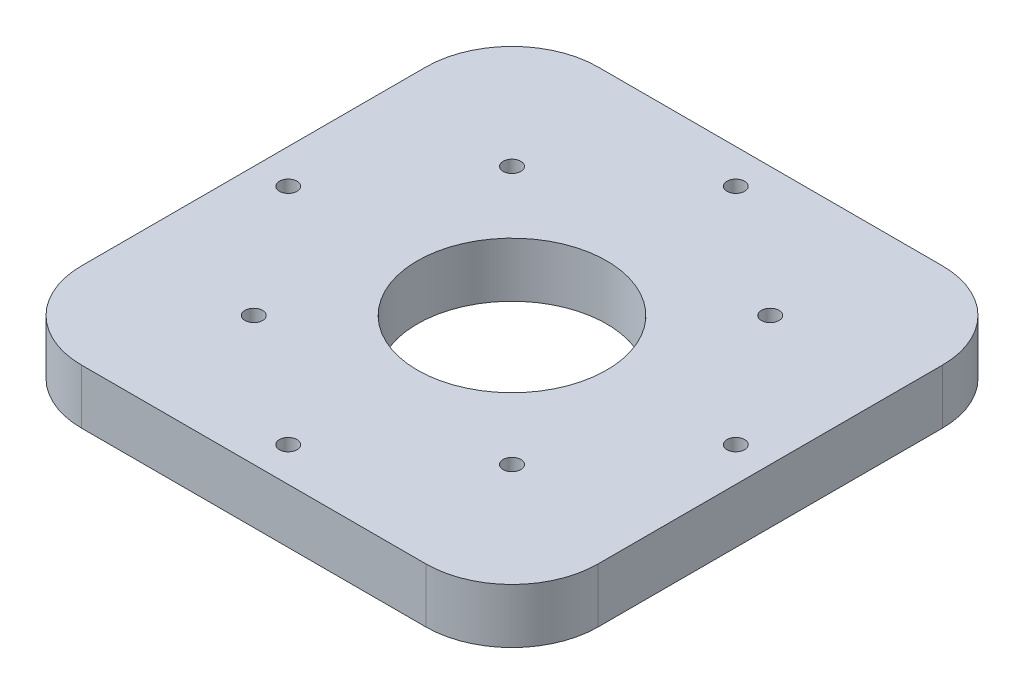
from build123d import *

# Parameters (mm, degrees)
SKETCH3_W           = 60
SKETCH3_H           = 60
SKETCH3_R           = 11
SKETCH3_R_2         = 1.025
BOSS_EXTRUDE1_DEPTH = 6.35
FILLET1_R           = 10
SKETCH4_R           = 1.025
CUT_EXTRUDE1_DEPTH  = 147.351937254


with BuildPart() as part:
    # Sketch3 → Boss-Extrude1 (new body)
    with BuildSketch(Plane(origin=(0, 0, 0), x_dir=(1, 0, 0), z_dir=(0, 1, 0))):
        with Locations((70, -76.67036626)):
            Rectangle(SKETCH3_W, SKETCH3_H)
        with Locations(Location((70, -76.67036626, 0), (0, 0, 270))):
            Circle(SKETCH3_R, mode=Mode.SUBTRACT)
        with Locations(Location((55, -61.67036626, 0), (0, 0, 270))):
            Circle(SKETCH3_R_2, mode=Mode.SUBTRACT)
        with Locations(Location((85, -61.67036626, 0), (0, 0, 270))):
            Circle(SKETCH3_R_2, mode=Mode.SUBTRACT)
        with Locations(Location((85, -91.67036626, 0), (0, 0, 270))):
            Circle(SKETCH3_R_2, mode=Mode.SUBTRACT)
        with Locations(Location((55, -91.67036626, 0), (0, 0, 270))):
            Circle(SKETCH3_R_2, mode=Mode.SUBTRACT)
    extrude(amount=BOSS_EXTRUDE1_DEPTH)

    # Fillet1
    fillet1_edges = [part.edges().sort_by_distance(p)[0] for p in [
        (40, 3.175, 46.67036626),
        (100, 3.175, 46.67036626),
        (100, 3.175, 106.67036626),
        (40, 3.175, 106.67036626),
    ]]
    fillet(fillet1_edges, radius=FILLET1_R)

    # Sketch4 → Cut-Extrude1 (cut, through all)
    with BuildSketch(Plane(origin=(0, 6.35, 0), x_dir=(1, 0, 0), z_dir=(0, 1, 0))):
        with Locations(Location((44, -76.67036626, 0), (0, 0, 270))):
            Circle(SKETCH4_R)
        with Locations(Location((96, -76.67036626, 0), (0, 0, 270))):
            Circle(SKETCH4_R)
        with Locations(Location((70, -50.67036626, 0), (0, 0, 270))):
            Circle(SKETCH4_R)
        with Locations(Location((70, -102.67036626, 0), (0, 0, 270))):
            Circle(SKETCH4_R)
    extrude(amount=-CUT_EXTRUDE1_DEPTH, mode=Mode.SUBTRACT)


solid = part.part
